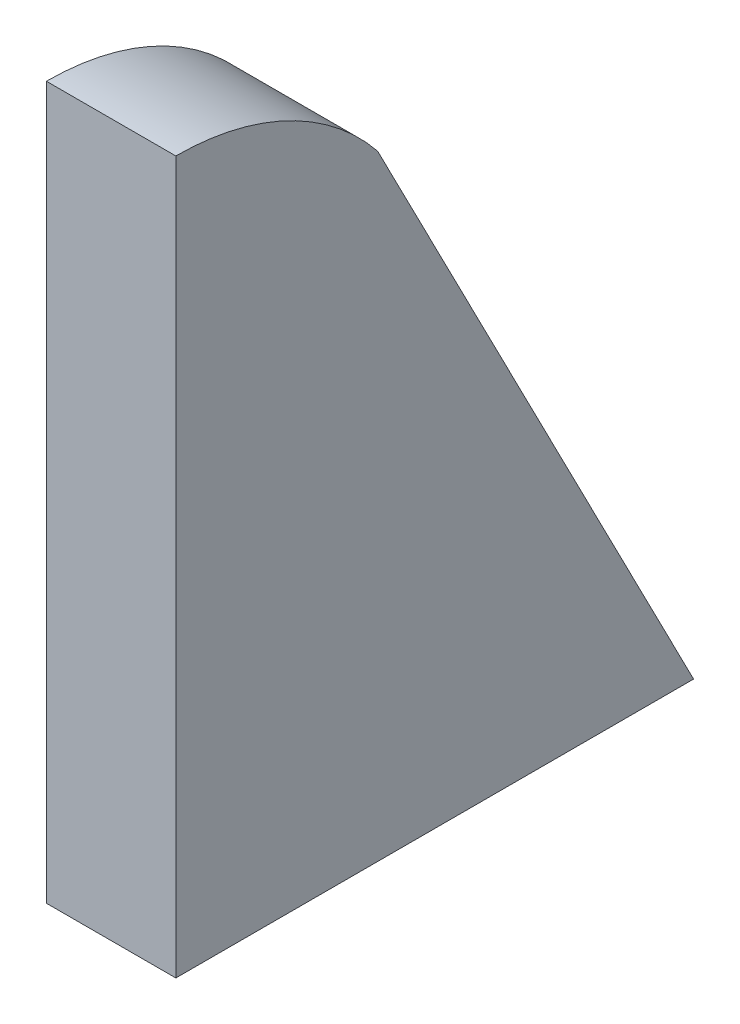
from build123d import *

# Parameters (mm, degrees)
BOSS_EXTRUDE1_DEPTH = 10


with BuildPart() as part:
    # Sketch2 → Boss-Extrude1 (new body)
    with BuildSketch(Plane(origin=(0, 0, 0), x_dir=(0, 0, -1), z_dir=(1, 0, 0))):
        with BuildLine():
            Line((0, 0), (40, 0))
            Line((40, 0), (15.585316345, 47.533870688))
            ThreePointArc((15.585316345, 47.533870688), (8.640676659, 53.03714797), (0, 55))
            Line((0, 55), (0, 0))
        make_face()
    extrude(amount=BOSS_EXTRUDE1_DEPTH)


solid = part.part
